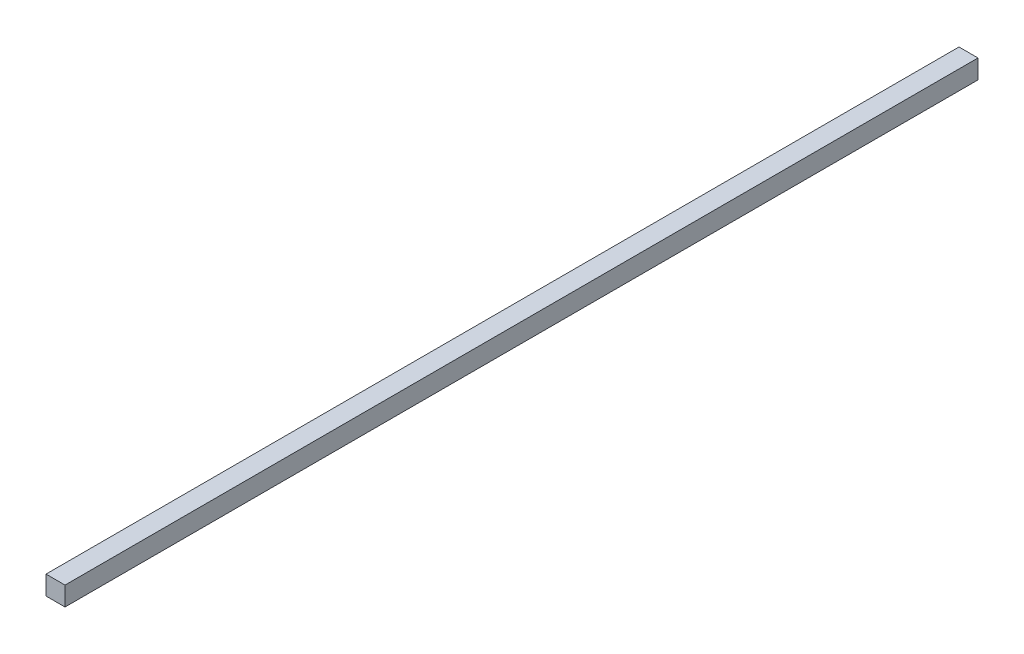
from build123d import *

# Parameters (mm, degrees)
SKETCH1_W           = 6.35
SKETCH1_H           = 6.35
BOSS_EXTRUDE1_DEPTH = 304.8


with BuildPart() as part:
    # Sketch1 → Boss-Extrude1 (new body)
    with BuildSketch(Plane.XY):
        with Locations((-8.218259767, 0.993311959)):
            Rectangle(SKETCH1_W, SKETCH1_H)
    extrude(amount=BOSS_EXTRUDE1_DEPTH)


solid = part.part
